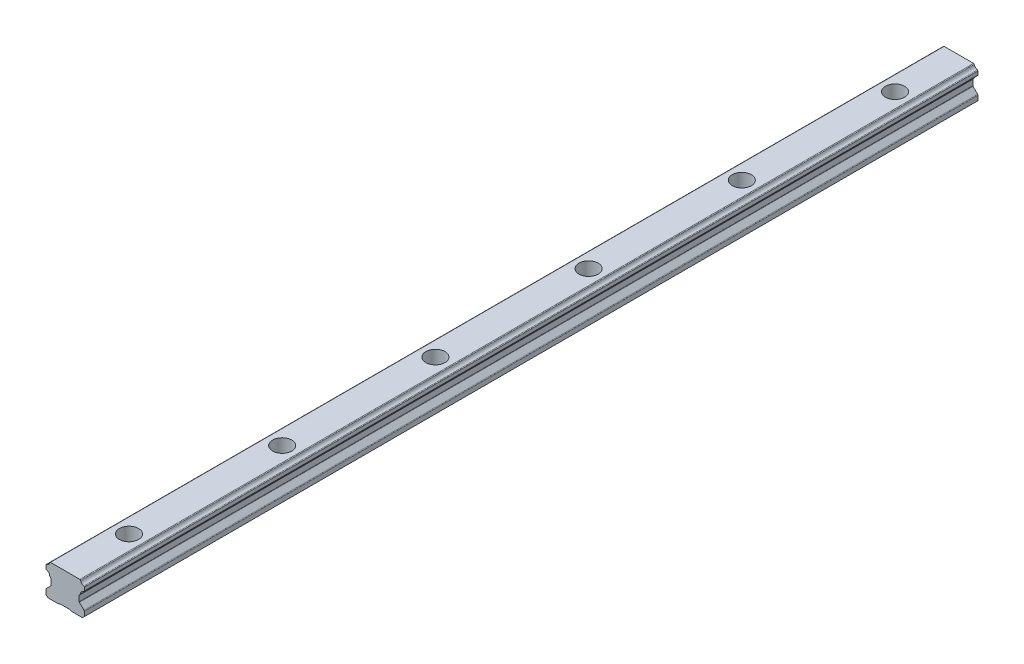
from build123d import *

# Parameters (mm, degrees)
BOSS_EXTRUDE101_DEPTH        = 350
SKETCH2_R                    = 1.5
CUT_EXTRUDE101_DEPTH         = 351.303439892
CHAMFER101_SIZE              = 0.7
FILLET101_R                  = 0.5
FILLET102_R                  = 0.3
FILLET103_R                  = 0.3
FILLET104_R                  = 0.3
CHAMFER101_OF_MIRROR101_SIZE = 0.7
FILLET101_OF_MIRROR101_R     = 0.5
FILLET102_OF_MIRROR101_R     = 0.3
FILLET103_OF_MIRROR101_R     = 0.3
FILLET104_OF_MIRROR101_R     = 0.3
CBORE101_D                   = 4.5
CBORE101_CBORE_D             = 7.5
CBORE101_CBORE_DEPTH         = 5.3
LPATTERN101_COUNT            = 6
LPATTERN101_PITCH            = 60


with BuildPart() as part:
    # Sketch1 → Boss-Extrude101 (new body)
    with BuildSketch(Plane.XY.offset(25)):
        Polygon((-2.05, 0.3), (0, 0.3), (0, 12.5), (-7.5, 12.5), (-7.5, 7.1), (-5.5, 7.1), (-5.5, 4.7), (-7.5, 2.7), (-7.5, 0), (-2.35, 0), align=None)
    boss_extrude101 = extrude(amount=-BOSS_EXTRUDE101_DEPTH)

    # Sketch2 → Cut-Extrude101 (cut, through all)
    with BuildSketch(Plane.XY.offset(25)):
        with Locations((-7.53, 12.53)):
            Circle(SKETCH2_R)
        with BuildLine():
            Line((-5.5, 7.1), (-6.030519656, 7.630519656))
            ThreePointArc((-6.030519656, 7.630519656), (-8.576608686, 8.744527923), (-7.53, 6.17))
            Line((-7.53, 6.17), (-7.5, 2.7))
            Line((-7.5, 2.7), (-5.5, 4.7))
            Line((-5.5, 4.7), (-5.5, 7.1))
        make_face()
    cut_extrude101 = extrude(amount=-CUT_EXTRUDE101_DEPTH, mode=Mode.SUBTRACT)

    # Chamfer101
    chamfer101_edges = [part.edges().sort_by_distance(p)[0] for p in [
        (-7.5, 0, -150),
    ]]
    chamfer(chamfer101_edges, length=CHAMFER101_SIZE)

    # Fillet101
    fillet101_edges = [part.edges().sort_by_distance(p)[0] for p in [
        (-7.5, 2.7, -150),
    ]]
    fillet(fillet101_edges, radius=FILLET101_R)

    # Fillet102
    fillet102_edges = [part.edges().sort_by_distance(p)[0] for p in [
        (-5.5, 7.1, -150),
    ]]
    fillet(fillet102_edges, radius=FILLET102_R)

    # Fillet103
    fillet103_edges = [part.edges().sort_by_distance(p)[0] for p in [
        (-7.5, 11.03030003, -150),
        (-6.03030003, 12.5, -150),
        (-7.5, 9.16969997, -150),
    ]]
    fillet(fillet103_edges, radius=FILLET103_R)

    # Fillet104
    fillet104_edges = [part.edges().sort_by_distance(p)[0] for p in [
        (-5.5, 4.7, -150),
    ]]
    fillet(fillet104_edges, radius=FILLET104_R)

    # Mirror101: Boss-Extrude101, Cut-Extrude101 across plane
    add(boss_extrude101.mirror(Plane(origin=(0, 0, 0), x_dir=(0, 0, 1), z_dir=(1, 0, 0))))
    add(cut_extrude101.mirror(Plane(origin=(0, 0, 0), x_dir=(0, 0, 1), z_dir=(1, 0, 0))), mode=Mode.SUBTRACT)

    # Chamfer101 of Mirror101
    chamfer101_of_mirror101_edges = [part.edges().sort_by_distance(p)[0] for p in [
        (7.5, 0, -150),
    ]]
    chamfer(chamfer101_of_mirror101_edges, length=CHAMFER101_OF_MIRROR101_SIZE)

    # Fillet101 of Mirror101
    fillet101_of_mirror101_edges = [part.edges().sort_by_distance(p)[0] for p in [
        (7.5, 2.7, -150),
    ]]
    fillet(fillet101_of_mirror101_edges, radius=FILLET101_OF_MIRROR101_R)

    # Fillet102 of Mirror101
    fillet102_of_mirror101_edges = [part.edges().sort_by_distance(p)[0] for p in [
        (5.5, 7.1, -150),
    ]]
    fillet(fillet102_of_mirror101_edges, radius=FILLET102_OF_MIRROR101_R)

    # Fillet103 of Mirror101
    fillet103_of_mirror101_edges = [part.edges().sort_by_distance(p)[0] for p in [
        (7.5, 11.03030003, -150),
        (6.03030003, 12.5, -150),
        (7.5, 9.16969997, -150),
    ]]
    fillet(fillet103_of_mirror101_edges, radius=FILLET103_OF_MIRROR101_R)

    # Fillet104 of Mirror101
    fillet104_of_mirror101_edges = [part.edges().sort_by_distance(p)[0] for p in [
        (5.5, 4.7, -150),
    ]]
    fillet(fillet104_of_mirror101_edges, radius=FILLET104_OF_MIRROR101_R)

    # CBORE101 (through all)
    with Locations(Plane(origin=(0, 12.5, 0), x_dir=(1, 0, 0), z_dir=(0, 1, 0))):
        with Locations((0, 0)):
            cbore101 = CounterBoreHole(CBORE101_D / 2, CBORE101_CBORE_D / 2, CBORE101_CBORE_DEPTH)

    # LPattern101: CBORE101 ×6
    with Locations(*[(0, 0, -i * LPATTERN101_PITCH) for i in range(1, LPATTERN101_COUNT)]):
        add(cbore101, mode=Mode.SUBTRACT)


solid = part.part
